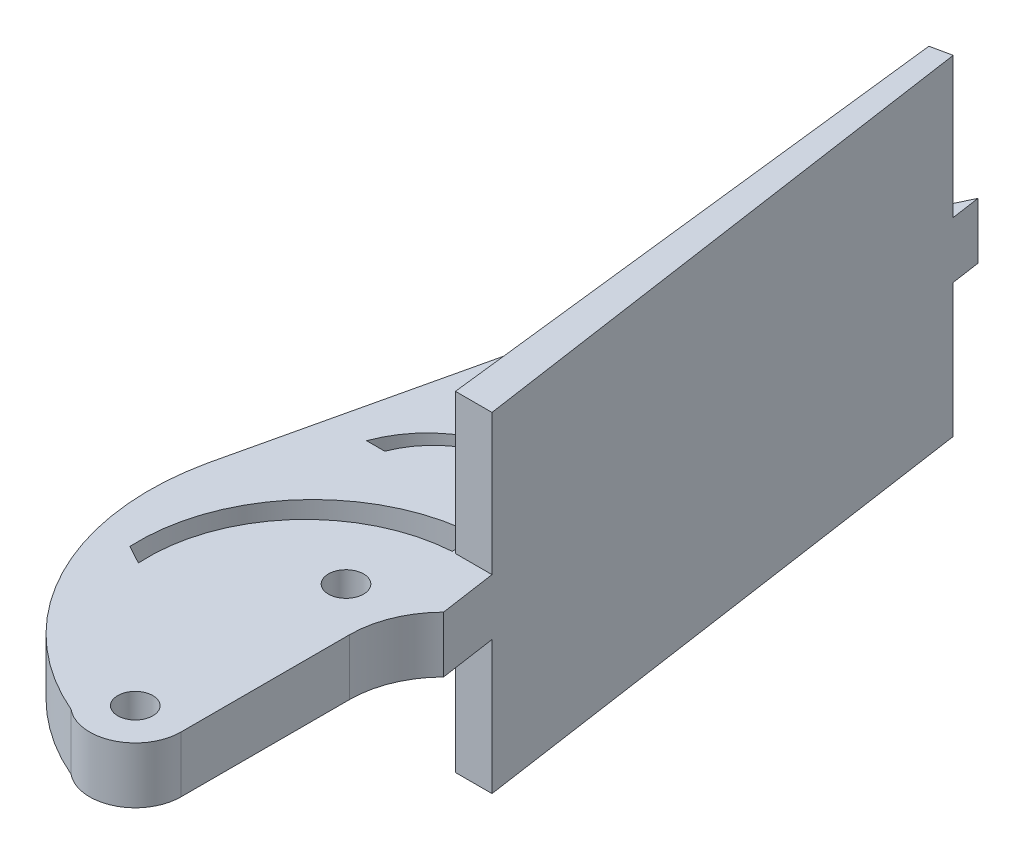
from build123d import *

# Parameters (mm, degrees)
CROQUIS2_R               = 2.5
SALIENTE_EXTRUIR1_DEPTH  = 8
BOSS_EXTRUDE1_DEPTH      = 8
CUT_EXTRUDE1_DEPTH       = 8
CUT_EXTRUDE2_DEPTH       = 8
CUT_EXTRUDE3_DEPTH       = 8
BOSS_EXTRUDE2_DEPTH      = 19
BOSS_EXTRUDE2_DEPTH_BACK = 28


with BuildPart() as part:
    # Croquis2 → Saliente-Extruir1 (new body)
    with BuildSketch(Plane(origin=(0, 0, 0), x_dir=(1, 0, 0), z_dir=(0, 1, 0))):
        with BuildLine():
            Line((10.408146681, 33.484891271), (-2.565348209, 122.544918389))
            Line((-2.565348209, 122.544918389), (-6.5, 114.275467894))
            Line((-6.5, 114.275467894), (-6.5, 70))
            Line((-6.5, 70), (-6.5, 0))
            ThreePointArc((-6.5, 0), (0, -6.5), (6.5, 0))
            Line((6.5, 0), (6.5, 24))
            ThreePointArc((6.5, 24), (7.515319953, 29.129248797), (10.408146681, 33.484891271))
        make_face()
        with Locations(Location((0, 0, 0), (0, 0, 270))):
            Circle(CROQUIS2_R, mode=Mode.SUBTRACT)
        with Locations(Location((0, 30, 0), (0, 0, 270))):
            Circle(CROQUIS2_R, mode=Mode.SUBTRACT)
    extrude(amount=SALIENTE_EXTRUIR1_DEPTH)

    # Sketch1 → Boss-Extrude1 (add)
    with BuildSketch(Plane(origin=(0, 0, 0), x_dir=(-1, 0, 0), z_dir=(0, -1, 0))):
        with BuildLine():
            ThreePointArc((4.128942059, -5.020143173), (21.647746033, 11.328640903), (24.761644954, 35.087741621))
            Line((24.761644954, 35.087741621), (6.5, 114.275467894))
            Line((6.5, 114.275467894), (6.5, 0))
            ThreePointArc((6.5, 0), (6.46955751, -0.628351518), (6.378515191, -1.250817318))
            ThreePointArc((6.378515191, -1.250817318), (5.581542691, -3.331123112), (4.128942059, -5.020143173))
        make_face()
    extrude(amount=-BOSS_EXTRUDE1_DEPTH)

    # Sketch2 → Cut-Extrude1 (cut)
    with BuildSketch(Plane(origin=(0, 0, 0), x_dir=(-1, 0, 0), z_dir=(0, -1, 0))):
        with BuildLine():
            Line((17.370234703, 17.816064827), (20.022873599, 19.251371951))
            ThreePointArc((20.022873599, 19.251371951), (13.643712801, 37.157358361), (-3.528479472, 45.308054917))
            Line((-3.528479472, 45.308054917), (-3.528479472, 41.585393249))
            ThreePointArc((-3.528479472, 41.585393249), (11.843666716, 34.028994462), (17.370234703, 17.816064827))
        make_face()
    extrude(amount=-CUT_EXTRUDE1_DEPTH, mode=Mode.SUBTRACT)

    # Sketch3 → Cut-Extrude2 (cut)
    with BuildSketch(Plane(origin=(0, 0, 0), x_dir=(-1, 0, 0), z_dir=(0, -1, 0))):
        with BuildLine():
            Line((13.617187508, 49.133891817), (16.20693955, 49.133891817))
            ThreePointArc((16.20693955, 49.133891817), (8.831529271, 57.239594637), (-2.115270782, 57.755989445))
            Line((-2.115270782, 57.755989445), (-2.115270782, 56.050896345))
            ThreePointArc((-2.115270782, 56.050896345), (7.183516906, 55.850692877), (13.617187508, 49.133891817))
        make_face()
    extrude(amount=-CUT_EXTRUDE2_DEPTH, mode=Mode.SUBTRACT)

    # Sketch4 → Cut-Extrude3 (cut)
    with BuildSketch(Plane(origin=(0, 0, 0), x_dir=(-1, 0, 0), z_dir=(0, -1, 0))):
        with BuildLine():
            Line((11.367603777, 69.893539148), (13.075452067, 70.772160082))
            ThreePointArc((13.075452067, 70.772160082), (8.326822135, 77.799434944), (0, 79.410680226))
            Line((0, 79.410680226), (0, 76.04148357))
            ThreePointArc((0, 76.04148357), (6.957082869, 75.321819187), (11.367603777, 69.893539148))
        make_face()
    extrude(amount=-CUT_EXTRUDE3_DEPTH, mode=Mode.SUBTRACT)

    # Sketch5 → Boss-Extrude2 (add, two sides: drawn at the far end of the back side and taken through both)
    with BuildSketch(Plane(origin=(0, 0, 0), x_dir=(-1, 0, 0), z_dir=(0, -1, 0)).offset(-BOSS_EXTRUDE2_DEPTH_BACK)):
        Polygon((-9.233196645, 41.550650182), (1.963037177, 118.410193142), (4.819417727, 117.807544593), (-4.03262502, 41.550650182), align=None)
    extrude(amount=BOSS_EXTRUDE2_DEPTH + BOSS_EXTRUDE2_DEPTH_BACK)


solid = part.part
